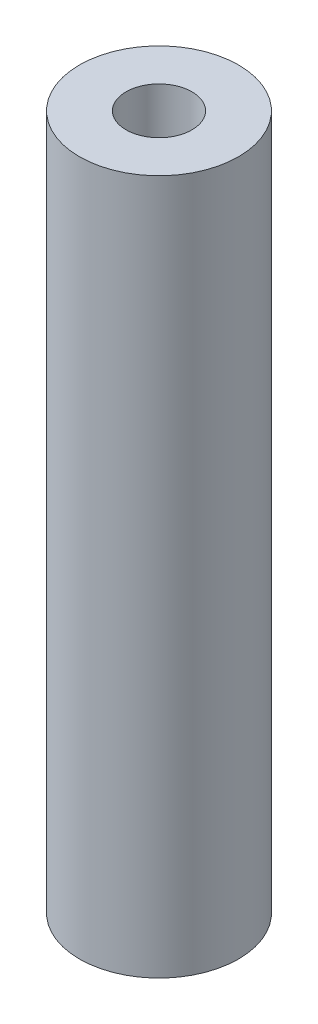
from build123d import *

# Parameters (mm, degrees)
SKETCH1_R           = 7.415
SKETCH1_R_2         = 3.075
BOSS_EXTRUDE1_DEPTH = 64.78


with BuildPart() as part:
    # Sketch1 → Boss-Extrude1 (new body)
    with BuildSketch(Plane(origin=(0, 0, 0), x_dir=(1, 0, 0), z_dir=(0, 1, 0))):
        with Locations(Location((0, 0, 0), (0, 0, 270))):
            Circle(SKETCH1_R)
        with Locations(Location((0, 0, 0), (0, 0, 270))):
            Circle(SKETCH1_R_2, mode=Mode.SUBTRACT)
    extrude(amount=BOSS_EXTRUDE1_DEPTH)


solid = part.part
